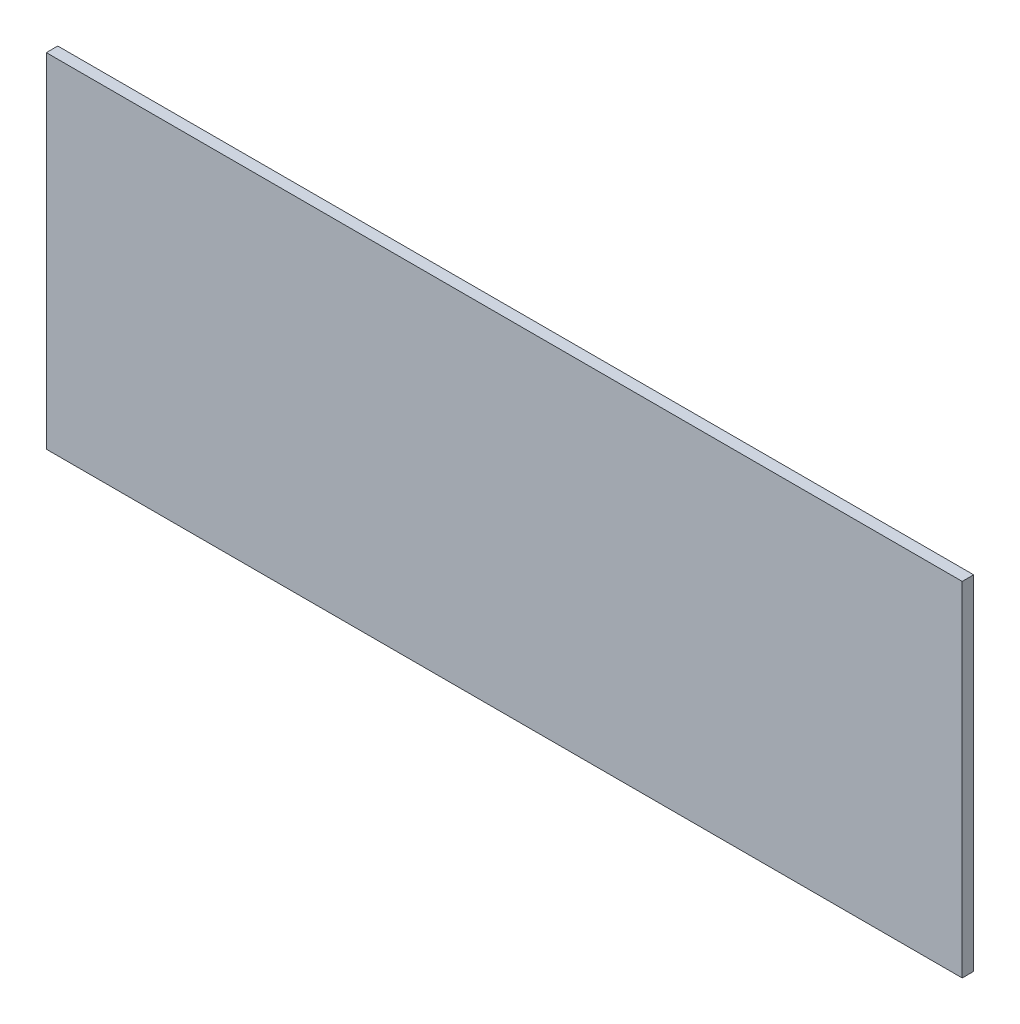
from build123d import *

# Parameters (mm, degrees)
SKETCH_1_W      = 80
SKETCH_1_H      = 30
EXTRUDE_1_DEPTH = 1


with BuildPart() as part:
    # 草圖1 → 填料-伸長1 (new body)
    with BuildSketch(Plane.XY):
        with Locations((-40, 15)):
            Rectangle(SKETCH_1_W, SKETCH_1_H)
    extrude(amount=EXTRUDE_1_DEPTH)


solid = part.part
